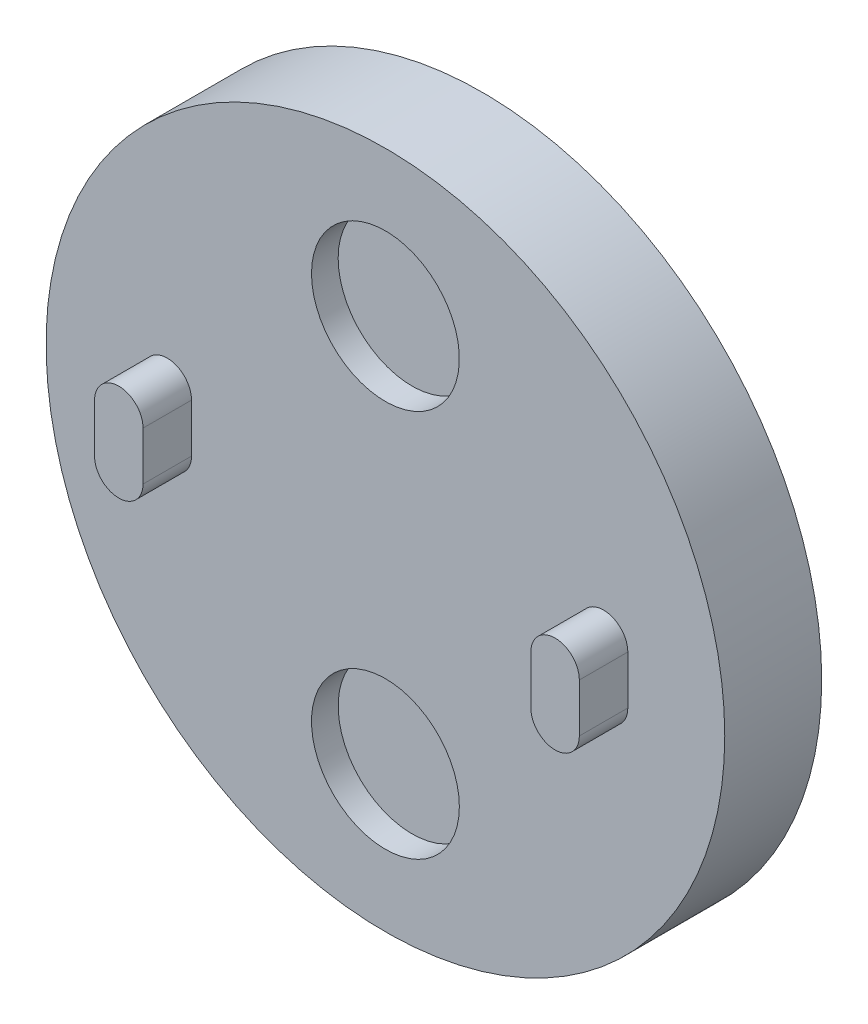
from build123d import *

# Parameters (mm, degrees)
BOSS_EXTRUDE1_DEPTH      = 1
BOSS_EXTRUDE1_DEPTH_BACK = 3
SKETCH3_R                = 14
SKETCH6_R                = 3.05
CUT_EXTRUDE2_DEPTH       = 1.1
BOSS_EXTRUDE2_DEPTH      = 2
CUT_EXTRUDE3_DEPTH       = 3


with BuildPart() as part:
    # Sketch3 → Boss-Extrude1 (new, two sides: drawn at the far end of the back side and taken through both)
    with BuildSketch(Plane.XY.offset(-51.612811659).offset(-BOSS_EXTRUDE1_DEPTH_BACK)):
        with Locations((0, 8)):
            Circle(SKETCH3_R)
    extrude(amount=BOSS_EXTRUDE1_DEPTH + BOSS_EXTRUDE1_DEPTH_BACK)

    # Sketch6 → Cut-Extrude2 (cut)
    with BuildSketch(Plane.XY.offset(-50.612811659)):
        Circle(SKETCH6_R)
        with Locations(Location((0, 16, 0), (0, 0, 180))):
            Circle(SKETCH6_R)
    extrude(amount=-CUT_EXTRUDE2_DEPTH, mode=Mode.SUBTRACT)

    # Sketch7 → Boss-Extrude2 (add)
    with BuildSketch(Plane.XY.offset(-50.612811659)):
        with BuildLine():
            Line((-8, 9), (-8, 7))
            ThreePointArc((-8, 7), (-9, 6), (-10, 7))
            Line((-10, 7), (-10, 9))
            ThreePointArc((-10, 9), (-9, 10), (-8, 9))
        make_face()
        with BuildLine():
            Line((8, 9), (8, 7))
            ThreePointArc((8, 7), (9, 6), (10, 7))
            Line((10, 7), (10, 9))
            ThreePointArc((10, 9), (9, 10), (8, 9))
        make_face()
    extrude(amount=BOSS_EXTRUDE2_DEPTH)

    # Sketch8 → Cut-Extrude3 (cut)
    with BuildSketch(Plane(origin=(0, 0, -54.612811659), x_dir=(-1, 0, 0), z_dir=(0, 0, -1))):
        with BuildLine():
            Line((-1.55, 10.024845673), (-1.55, 5.975154327))
            ThreePointArc((-1.55, 5.975154327), (0, 5.45), (1.55, 5.975154327))
            Line((1.55, 5.975154327), (1.55, 10.024845673))
            ThreePointArc((1.55, 10.024845673), (0, 10.55), (-1.55, 10.024845673))
        make_face()
    extrude(amount=-CUT_EXTRUDE3_DEPTH, mode=Mode.SUBTRACT)


solid = part.part
